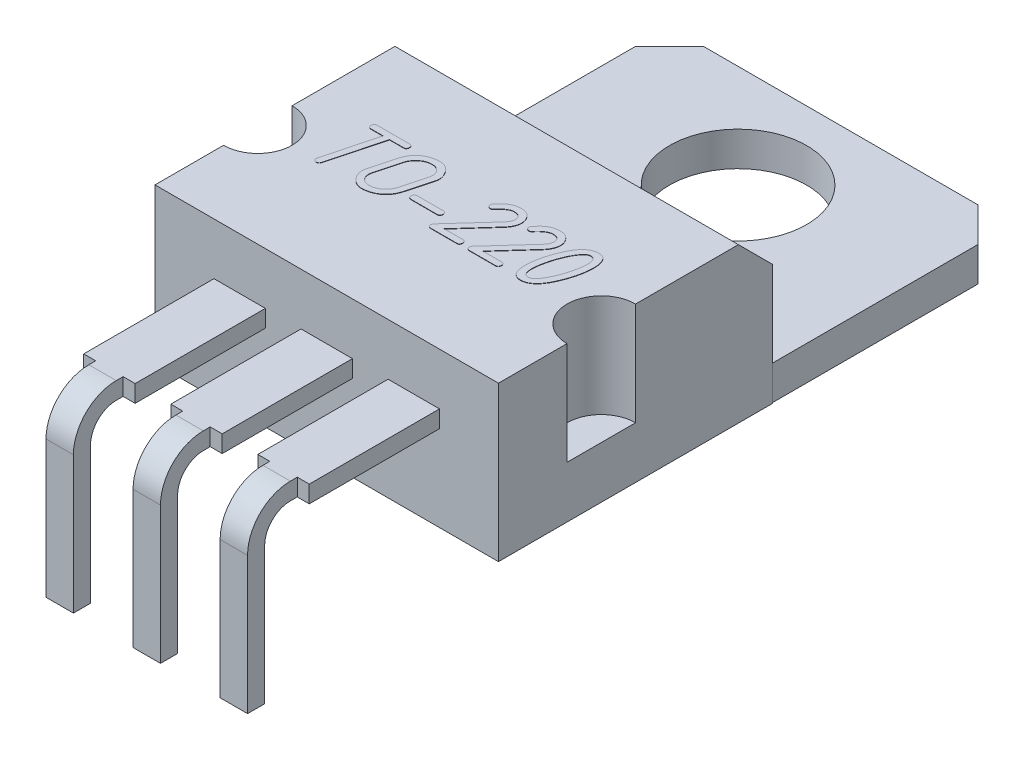
from build123d import *

# Parameters (mm, degrees)
SKETCH_1_R                  = 2
EXTRUDE_1_DEPTH             = 1
EXTRUDE_3_DEPTH             = 1.01
SKETCH_2_5_W                = 10.02
SKETCH_2_5_H                = 8
EXTRUDE_4_DEPTH             = 3.5
SKETCH_3_W                  = 1.5
SKETCH_3_H                  = 0.5
EXTRUDE_5_DEPTH             = 3.8
SKETCH_4_W                  = 0.8
SKETCH_4_H                  = 0.5
PATTERN_LINEAR_1_COUNT      = 2
PATTERN_LINEAR_1_PITCH      = 2.54
PATTERN_LINEAR_1_COUNT_DIR2 = 2
PATTERN_LINEAR_1_PITCH_DIR2 = 2.54
EXTRUDE_6_DEPTH             = 0.01
CHAMFER_1_SIZE              = 1
SKETCH_9_R                  = 1
CUT_EXTRUDE_1_DEPTH         = 3


with BuildPart() as part:
    # Эскиз1 → Бобышка-Вытянуть1 (new body)
    with BuildSketch(Plane(origin=(0, 0, 0), x_dir=(1, 0, 0), z_dir=(0, 1, 0))):
        Polygon((0, 0), (8, 0), (8, 6), (9, 6), (9, 12), (8, 13), (0, 13), (-1, 12), (-1, 6), (0, 6), align=None)
        with Locations((4, 10)):
            Circle(SKETCH_1_R, mode=Mode.SUBTRACT)
    extrude(amount=EXTRUDE_1_DEPTH)

    # Эскиз2 → Бобышка-Вытянуть3 (add)
    with BuildSketch(Plane(origin=(0, 1, 0), x_dir=(1, 0, 0), z_dir=(0, 1, 0))):
        Polygon((-1, 6), (-1.01, 6), (-1.01, -2), (9.01, -2), (9.01, 6), (9, 6), (8, 6), (8, 0), (0, 0), (0, 6), align=None)
    extrude(amount=-EXTRUDE_3_DEPTH)

    # Эскиз2<5> → Бобышка-Вытянуть4 (add)
    with BuildSketch(Plane(origin=(0, 1, 0), x_dir=(1, 0, 0), z_dir=(0, 1, 0))):
        with Locations((4, 2)):
            Rectangle(SKETCH_2_5_W, SKETCH_2_5_H)
    extrude(amount=EXTRUDE_4_DEPTH)

    # Эскиз3 → Бобышка-Вытянуть5 (add)
    with BuildSketch(Plane.XY.offset(2)):
        with Locations((4, 2.74)):
            Rectangle(SKETCH_3_W, SKETCH_3_H)
    extrude_5 = extrude(amount=EXTRUDE_5_DEPTH)

    # По траектории1: sweep along a path in Эскиз7
    with BuildLine(Plane.ZY.offset(-4)) as sweep_1_path:
        Line((5.8, 2.74), (6, 2.74))
        ThreePointArc((6, 2.74), (6.707106781, 2.447106781), (7, 1.74))
        Line((7, 1.74), (7, -2.26))
    # Эскиз4 → По траектории1 (sweep)
    with BuildSketch(Plane.XY.offset(5.8)):
        with Locations((4, 2.74)):
            Rectangle(SKETCH_4_W, SKETCH_4_H)
    sweep_1 = sweep(path=sweep_1_path.line)

    # Линейный массив1: Бобышка-Вытянуть5, Sweep 1 2 × 2
    with Locations(*[Vector(-1, 0, 0) * (i * PATTERN_LINEAR_1_PITCH) + Vector(1, 0, 0) * (j * PATTERN_LINEAR_1_PITCH_DIR2) for i in range(PATTERN_LINEAR_1_COUNT) for j in range(PATTERN_LINEAR_1_COUNT_DIR2) if (i, j) != (0, 0)]):
        add(extrude_5)
        add(sweep_1)

    # Эскиз8 → Бобышка-Вытянуть6 (add)
    # profile 1 of 6: a face of its own
    with BuildSketch(Plane(origin=(0, 4.5, 0), x_dir=(1, 0, 0), z_dir=(0, 1, 0))):
        with BuildLine():
            Line((1.27858567, 2.5547293), (0.859157599, 0.985020757))
            add(Edge.make_bspline(
                [(0.859157599, 0.985020757), (0.855633438, 0.974783342), (0.849087007, 0.955766466), (0.829278615, 0.93328717), (0.803143513, 0.919336806), (0.783409322, 0.918209838), (0.773079427, 0.917619925)],
                knots=[0, 0, 0, 0, 1.086908555, 2.019025704, 2.963055697, 4, 4, 4, 4], degree=3))
            add(Edge.make_bspline(
                [(0.773079427, 0.917619925), (0.767204868, 0.917864101), (0.755608941, 0.918346085), (0.739020981, 0.924335999), (0.722879767, 0.932189694), (0.708692809, 0.944021025), (0.696472399, 0.957627118), (0.687400283, 0.972740133), (0.681742621, 0.98896155), (0.681188277, 1.000135496), (0.680910819, 1.005728242)],
                knots=[0, 0, 0, 0, 0.998523784, 1.971008786, 2.984412935, 4.053273998, 5.101682541, 6.096988731, 7.047511114, 8, 8, 8, 8], degree=3))
            add(Edge.make_bspline(
                [(0.680910819, 1.005728242), (0.681174471, 1.010217201), (0.681723788, 1.019569906), (0.684127251, 1.028627792), (0.685377139, 1.033338221)],
                knots=[0, 0, 0, 0, 0.959927375, 2, 2, 2, 2], degree=3))
            Line((0.685377139, 1.033338221), (1.091000221, 2.5547293))
            Line((1.091000221, 2.5547293), (0.740191069, 2.5547293))
            add(Edge.make_bspline(
                [(0.740191069, 2.5547293), (0.733142702, 2.555099355), (0.719732405, 2.555803425), (0.700802325, 2.559454679), (0.685008305, 2.567050286), (0.671761457, 2.577083859), (0.661525267, 2.59022733), (0.654625853, 2.606462916), (0.650032952, 2.625124331), (0.649779441, 2.638611333), (0.649646577, 2.645679821)],
                knots=[0, 0, 0, 0, 1.152245291, 2.192274096, 3.121243949, 3.987402553, 4.884564444, 5.804293213, 6.849238333, 8, 8, 8, 8], degree=3))
            add(Edge.make_bspline(
                [(0.649646577, 2.645679821), (0.649743167, 2.652894625), (0.649924046, 2.66640549), (0.654831047, 2.685073251), (0.661247518, 2.701465446), (0.672068578, 2.714215792), (0.684731012, 2.72490292), (0.701007181, 2.73161686), (0.719625863, 2.736254033), (0.733119241, 2.736500939), (0.740191069, 2.736630341)],
                knots=[0, 0, 0, 0, 1.171153265, 2.193170214, 3.131774486, 4.010381834, 4.888989181, 5.807411693, 6.850872717, 8, 8, 8, 8], degree=3))
            Line((0.740191069, 2.736630341), (1.677306257, 2.736630341))
            add(Edge.make_bspline(
                [(1.677306257, 2.736630341), (1.684378085, 2.736500939), (1.697871463, 2.736254033), (1.716490145, 2.73161686), (1.732766314, 2.72490292), (1.745428748, 2.714215792), (1.756249808, 2.701465446), (1.762666279, 2.685073251), (1.76757328, 2.66640549), (1.767754159, 2.652894625), (1.767850749, 2.645679821)],
                knots=[0, 0, 0, 0, 1.149127283, 2.192588307, 3.111010819, 3.989618166, 4.868225514, 5.806829786, 6.828846735, 8, 8, 8, 8], degree=3))
            add(Edge.make_bspline(
                [(1.767850749, 2.645679821), (1.767717885, 2.638611333), (1.767464374, 2.625124331), (1.762871473, 2.606462916), (1.755972059, 2.59022733), (1.745735869, 2.577083859), (1.732489021, 2.567050286), (1.716695001, 2.559454679), (1.697764921, 2.555803425), (1.684354624, 2.555099355), (1.677306257, 2.5547293)],
                knots=[0, 0, 0, 0, 1.150761667, 2.195706787, 3.115435556, 4.012597447, 4.878756051, 5.807725904, 6.847754709, 8, 8, 8, 8], degree=3))
            Line((1.677306257, 2.5547293), (1.27858567, 2.5547293))
        make_face()
    # profile 2 of 6: a face of its own
    with BuildSketch(Plane(origin=(0, 4.5, 0), x_dir=(1, 0, 0), z_dir=(0, 1, 0))):
        with BuildLine():
            add(Edge.make_bspline(
                [(2.795104399, 1.46332305), (2.786928876, 1.435359174), (2.770956207, 1.380725643), (2.737010598, 1.304094516), (2.697657346, 1.233771974), (2.651951592, 1.169746038), (2.599331694, 1.112551879), (2.539870738, 1.062550924), (2.474692985, 1.018271023), (2.42702941, 0.995393666), (2.402880278, 0.98380267)],
                knots=[0, 0, 0, 0, 1.08866662, 2.126947775, 3.126561852, 4.09871457, 5.062408504, 6.024945022, 6.999322605, 8, 8, 8, 8], degree=3))
            add(Edge.make_bspline(
                [(2.402880278, 0.98380267), (2.378313867, 0.973613917), (2.329126592, 0.953213826), (2.251070685, 0.932898784), (2.170000672, 0.919735969), (2.114653013, 0.918331963), (2.086583601, 0.917619925)],
                knots=[0, 0, 0, 0, 0.979423391, 1.961017766, 2.965935817, 4, 4, 4, 4], degree=3))
            add(Edge.make_bspline(
                [(2.086583601, 0.917619925), (2.068099229, 0.918506111), (2.031082888, 0.920280766), (1.97641298, 0.933954309), (1.922785348, 0.955983), (1.889641331, 0.977040177), (1.872606259, 0.987862961)],
                knots=[0, 0, 0, 0, 0.969629375, 1.941755521, 2.942121495, 4, 4, 4, 4], degree=3))
            add(Edge.make_bspline(
                [(1.872606259, 0.987862961), (1.857284238, 0.999280668), (1.826674514, 1.02209051), (1.785994525, 1.06285397), (1.749783225, 1.108138787), (1.718218433, 1.157282587), (1.692723202, 1.209468583), (1.673769115, 1.263195678), (1.662388069, 1.318163482), (1.660964025, 1.355132764), (1.660253034, 1.373590616)],
                knots=[0, 0, 0, 0, 1.002747793, 2.003249617, 3.014831478, 4.044394242, 5.065129976, 6.059016044, 7.03091446, 8, 8, 8, 8], degree=3))
            add(Edge.make_bspline(
                [(1.660253034, 1.373590616), (1.660698514, 1.389217442), (1.661561083, 1.419475189), (1.668068975, 1.449031367), (1.67121582, 1.46332305)],
                knots=[0, 0, 0, 0, 1.03291398, 2, 2, 2, 2], degree=3))
            Line((1.67121582, 1.46332305), (1.865703764, 2.190927216))
            add(Edge.make_bspline(
                [(1.865703764, 2.190927216), (1.873980736, 2.218847582), (1.890156577, 2.273412876), (1.922695379, 2.350666683), (1.962400108, 2.420860805), (2.008013489, 2.48481578), (2.060378407, 2.542062832), (2.119197819, 2.592682947), (2.184616777, 2.636704017), (2.232178681, 2.659899905), (2.256303769, 2.671665684)],
                knots=[0, 0, 0, 0, 1.088804569, 2.127871211, 3.127611952, 4.099887855, 5.06028041, 6.022379573, 6.996880622, 8, 8, 8, 8], degree=3))
            add(Edge.make_bspline(
                [(2.256303769, 2.671665684), (2.28087072, 2.681727254), (2.330193321, 2.701927677), (2.408420464, 2.72172286), (2.489621465, 2.734416018), (2.544940948, 2.73588505), (2.573006476, 2.736630341)],
                knots=[0, 0, 0, 0, 0.977386569, 1.962280486, 2.966192936, 4, 4, 4, 4], degree=3))
            add(Edge.make_bspline(
                [(2.573006476, 2.736630341), (2.591746407, 2.735993457), (2.628638946, 2.734739649), (2.682372216, 2.722836434), (2.733257287, 2.704088958), (2.781151244, 2.677835473), (2.825952793, 2.644012243), (2.867342026, 2.602481363), (2.906375224, 2.553851), (2.928562719, 2.517251409), (2.940056792, 2.498291253)],
                knots=[0, 0, 0, 0, 0.975824583, 1.921066047, 2.854300508, 3.795318588, 4.757785637, 5.770664113, 6.845108518, 8, 8, 8, 8], degree=3))
            add(Edge.make_bspline(
                [(2.940056792, 2.498291253), (2.949664431, 2.480804137), (2.968482767, 2.44655239), (2.987087534, 2.391882215), (2.999876632, 2.337151111), (3.001143817, 2.300220739), (3.001773217, 2.281877737)],
                knots=[0, 0, 0, 0, 1.049868008, 2.056360327, 3.034610701, 4, 4, 4, 4], degree=3))
            add(Edge.make_bspline(
                [(3.001773217, 2.281877737), (3.001347839, 2.266649752), (3.000489053, 2.235906277), (2.993247154, 2.20601342), (2.989592343, 2.190927216)],
                knots=[0, 0, 0, 0, 0.99064829, 2, 2, 2, 2], degree=3))
            Line((2.989592343, 2.190927216), (2.795104399, 1.46332305))
        make_face()
        with BuildLine():
            Line((2.607112921, 1.46332305), (2.802006894, 2.190927216))
            add(Edge.make_bspline(
                [(2.802006894, 2.190927216), (2.80566221, 2.205740875), (2.812805325, 2.234689311), (2.813734214, 2.264486387), (2.814187767, 2.279035533)],
                knots=[0, 0, 0, 0, 1.023451362, 2, 2, 2, 2], degree=3))
            add(Edge.make_bspline(
                [(2.814187767, 2.279035533), (2.813910445, 2.292204149), (2.81337161, 2.317790639), (2.80594266, 2.354669122), (2.795395541, 2.389232321), (2.779053093, 2.420693911), (2.759166618, 2.449888457), (2.734406398, 2.476202822), (2.704894397, 2.499356146), (2.682929831, 2.51234242), (2.671671549, 2.518998738)],
                knots=[0, 0, 0, 0, 1.07079464, 2.080543449, 3.053262812, 4.004823275, 4.955872695, 5.923015894, 6.935409288, 8, 8, 8, 8], degree=3))
            add(Edge.make_bspline(
                [(2.671671549, 2.518998738), (2.660309844, 2.524636747), (2.637648961, 2.535881738), (2.600940628, 2.546359094), (2.562895324, 2.553879108), (2.536774468, 2.554442407), (2.523470924, 2.5547293)],
                knots=[0, 0, 0, 0, 0.986514322, 1.967599494, 2.964883452, 4, 4, 4, 4], degree=3))
            add(Edge.make_bspline(
                [(2.523470924, 2.5547293), (2.506112298, 2.554192164), (2.471723503, 2.553128058), (2.421146577, 2.544354378), (2.372272589, 2.529973084), (2.324988204, 2.509979398), (2.279265417, 2.484180699), (2.235286078, 2.452624973), (2.192758886, 2.415580175), (2.166846217, 2.387305477), (2.153578404, 2.372828258)],
                knots=[0, 0, 0, 0, 0.978320997, 1.938130408, 2.884772499, 3.845794787, 4.826494249, 5.838756166, 6.893399279, 8, 8, 8, 8], degree=3))
            add(Edge.make_bspline(
                [(2.153578404, 2.372828258), (2.141840253, 2.358750626), (2.118952051, 2.331300673), (2.09124937, 2.286035237), (2.068351634, 2.239751663), (2.058539163, 2.207063639), (2.053695243, 2.190927216)],
                knots=[0, 0, 0, 0, 1.049505148, 2.046428436, 3.035620582, 4, 4, 4, 4], degree=3))
            Line((2.053695243, 2.190927216), (1.859207299, 1.46332305))
            add(Edge.make_bspline(
                [(1.859207299, 1.46332305), (1.855588248, 1.448506838), (1.848513748, 1.419544194), (1.847241708, 1.38976164), (1.846620396, 1.375214733)],
                knots=[0, 0, 0, 0, 1.023125607, 2, 2, 2, 2], degree=3))
            add(Edge.make_bspline(
                [(1.846620396, 1.375214733), (1.846811631, 1.365319636), (1.847187947, 1.345847842), (1.851415929, 1.317435937), (1.857948174, 1.290399276), (1.866717956, 1.264665272), (1.878752068, 1.240568789), (1.893037066, 1.217738129), (1.909657568, 1.196007067), (1.935701123, 1.169789067), (1.972439451, 1.1414982), (2.022636045, 1.117325398), (2.077576397, 1.102060677), (2.115985772, 1.100382758), (2.135713123, 1.099520966)],
                knots=[0, 0, 0, 0, 0.796530066, 1.567429791, 2.307814666, 3.035325116, 3.7520546, 4.472010561, 5.202537203, 5.950349672, 7.443986541, 8.911614415, 10.41378132, 12, 12, 12, 12], degree=3))
            add(Edge.make_bspline(
                [(2.135713123, 1.099520966), (2.153069709, 1.100064994), (2.187454462, 1.101142755), (2.238227588, 1.109844502), (2.287313795, 1.124733988), (2.33495014, 1.144965901), (2.380781946, 1.171441743), (2.425095527, 1.203115286), (2.46777056, 1.240869371), (2.49382504, 1.269522512), (2.50722976, 1.284264212)],
                knots=[0, 0, 0, 0, 0.971607698, 1.924830837, 2.874400901, 3.838768323, 4.816476348, 5.832365049, 6.884777637, 8, 8, 8, 8], degree=3))
            add(Edge.make_bspline(
                [(2.50722976, 1.284264212), (2.518932365, 1.298363945), (2.541797296, 1.325912465), (2.569799469, 1.370576857), (2.592279365, 1.416090353), (2.602220536, 1.44774482), (2.607112921, 1.46332305)],
                knots=[0, 0, 0, 0, 1.062692188, 2.076322643, 3.053293563, 4, 4, 4, 4], degree=3))
        make_face(mode=Mode.SUBTRACT)
    # profile 3 of 6: a face of its own
    with BuildSketch(Plane(origin=(0, 4.5, 0), x_dir=(1, 0, 0), z_dir=(0, 1, 0))):
        with BuildLine():
            Line((3.852404204, 1.359379597), (3.104092553, 1.359379597))
            add(Edge.make_bspline(
                [(3.104092553, 1.359379597), (3.097044186, 1.359749652), (3.083633889, 1.360453722), (3.064703809, 1.364104977), (3.048909789, 1.371700583), (3.035662941, 1.381734156), (3.02542675, 1.394877628), (3.018527337, 1.411113214), (3.013934435, 1.429774628), (3.013680925, 1.443261631), (3.013548061, 1.450330118)],
                knots=[0, 0, 0, 0, 1.152245291, 2.192274096, 3.121243949, 3.987402553, 4.884564444, 5.804293213, 6.849238333, 8, 8, 8, 8], degree=3))
            add(Edge.make_bspline(
                [(3.013548061, 1.450330118), (3.01364465, 1.457544923), (3.013825529, 1.471055788), (3.01873253, 1.489723548), (3.025149002, 1.506115744), (3.035970061, 1.518866089), (3.048632495, 1.529553217), (3.064908664, 1.536267158), (3.083527346, 1.540904331), (3.097020724, 1.541151237), (3.104092553, 1.541280639)],
                knots=[0, 0, 0, 0, 1.171153265, 2.193170214, 3.131774486, 4.010381834, 4.888989181, 5.807411693, 6.850872717, 8, 8, 8, 8], degree=3))
            Line((3.104092553, 1.541280639), (3.852404204, 1.541280639))
            add(Edge.make_bspline(
                [(3.852404204, 1.541280639), (3.859476032, 1.541151237), (3.87296941, 1.540904331), (3.891588092, 1.536267158), (3.907864261, 1.529553217), (3.920526695, 1.518866089), (3.931347755, 1.506115744), (3.937764226, 1.489723548), (3.942671227, 1.471055788), (3.942852106, 1.457544923), (3.942948696, 1.450330118)],
                knots=[0, 0, 0, 0, 1.149127283, 2.192588307, 3.111010819, 3.989618166, 4.868225514, 5.806829786, 6.828846735, 8, 8, 8, 8], degree=3))
            add(Edge.make_bspline(
                [(3.942948696, 1.450330118), (3.942815832, 1.443261631), (3.942562321, 1.429774628), (3.93796942, 1.411113214), (3.931070006, 1.394877628), (3.920833816, 1.381734156), (3.907586968, 1.371700583), (3.891792948, 1.364104977), (3.872862868, 1.360453722), (3.859452571, 1.359749652), (3.852404204, 1.359379597)],
                knots=[0, 0, 0, 0, 1.150761667, 2.195706787, 3.115435556, 4.012597447, 4.878756051, 5.807725904, 6.847754709, 8, 8, 8, 8], degree=3))
        make_face()
    # profile 4 of 6: a face of its own
    with BuildSketch(Plane(origin=(0, 4.5, 0), x_dir=(1, 0, 0), z_dir=(0, 1, 0))):
        with BuildLine():
            add(Edge.make_bspline(
                [(4.549556187, 2.315984183), (4.54514884, 2.311040073), (4.536507867, 2.30134673), (4.520338463, 2.290491966), (4.501951989, 2.284214916), (4.489105062, 2.28347348), (4.482561384, 2.283095825)],
                knots=[0, 0, 0, 0, 1.025040379, 2.009677726, 2.986214628, 4, 4, 4, 4], degree=3))
            add(Edge.make_bspline(
                [(4.482561384, 2.283095825), (4.476565014, 2.283363955), (4.464731042, 2.283893115), (4.447840542, 2.289430928), (4.432415678, 2.298339767), (4.418439732, 2.309899507), (4.406631174, 2.323851075), (4.398640456, 2.339670029), (4.392756172, 2.356176446), (4.39226548, 2.367767981), (4.392016892, 2.373640316)],
                knots=[0, 0, 0, 0, 1.01324681, 1.999665296, 2.975361523, 4.017776151, 5.060190779, 6.045008368, 7.009590593, 8, 8, 8, 8], degree=3))
            add(Edge.make_bspline(
                [(4.392016892, 2.373640316), (4.393126861, 2.384079172), (4.39540975, 2.405548924), (4.407652361, 2.423362262), (4.413942464, 2.432514537)],
                knots=[0, 0, 0, 0, 0.972424466, 2, 2, 2, 2], degree=3))
            add(Edge.make_bspline(
                [(4.413942464, 2.432514537), (4.433809877, 2.456597176), (4.4717135, 2.50254273), (4.53051834, 2.564085326), (4.587949377, 2.615302963), (4.628038055, 2.642539487), (4.647003174, 2.655424519)],
                knots=[0, 0, 0, 0, 1.15629407, 2.206011236, 3.151301302, 4, 4, 4, 4], degree=3))
            add(Edge.make_bspline(
                [(4.647003174, 2.655424519), (4.669940338, 2.668096378), (4.715816201, 2.693440943), (4.791616254, 2.718016785), (4.871646986, 2.73425509), (4.926942313, 2.73582742), (4.955179269, 2.736630341)],
                knots=[0, 0, 0, 0, 0.972811039, 1.945687229, 2.950950411, 4, 4, 4, 4], degree=3))
            add(Edge.make_bspline(
                [(4.955179269, 2.736630341), (4.971719815, 2.736063023), (5.004059904, 2.734953802), (5.050985281, 2.726937923), (5.094633848, 2.712692907), (5.135689215, 2.693998989), (5.172699078, 2.668068866), (5.207277154, 2.637930595), (5.23846995, 2.601844933), (5.255720308, 2.574465331), (5.264573451, 2.560413707)],
                knots=[0, 0, 0, 0, 1.060694985, 2.073871789, 3.040117736, 3.999202584, 4.954982404, 5.926671157, 6.935936426, 8, 8, 8, 8], degree=3))
            add(Edge.make_bspline(
                [(5.264573451, 2.560413707), (5.272110813, 2.54637466), (5.287127284, 2.518405064), (5.303188523, 2.473263217), (5.312061128, 2.425691588), (5.313420327, 2.393300429), (5.314109003, 2.376888549)],
                knots=[0, 0, 0, 0, 0.993271713, 1.978867136, 2.97593695, 4, 4, 4, 4], degree=3))
            add(Edge.make_bspline(
                [(5.314109003, 2.376888549), (5.313670752, 2.361425981), (5.31278882, 2.330309224), (5.304599212, 2.283935103), (5.292054706, 2.237626219), (5.273937723, 2.191770002), (5.251172243, 2.145994866), (5.222717329, 2.100932884), (5.189873895, 2.055531216), (5.16466182, 2.026695947), (5.151697359, 2.011868378)],
                knots=[0, 0, 0, 0, 0.906955576, 1.825150615, 2.756077876, 3.719491966, 4.714332584, 5.752697099, 6.844400029, 8, 8, 8, 8], degree=3))
            Line((5.151697359, 2.011868378), (4.325022089, 1.099520966))
            Line((4.325022089, 1.099520966), (4.867476981, 1.099520966))
            add(Edge.make_bspline(
                [(4.867476981, 1.099520966), (4.87454881, 1.099391564), (4.888042187, 1.099144658), (4.906660869, 1.094507485), (4.922937038, 1.087793545), (4.935599472, 1.077106417), (4.946420532, 1.064356071), (4.952837003, 1.047963876), (4.957744004, 1.029296115), (4.957924883, 1.01578525), (4.958021473, 1.008570446)],
                knots=[0, 0, 0, 0, 1.149127283, 2.192588307, 3.111010819, 3.989618166, 4.868225514, 5.806829786, 6.828846735, 8, 8, 8, 8], degree=3))
            add(Edge.make_bspline(
                [(4.958021473, 1.008570446), (4.957888609, 1.001501958), (4.957635098, 0.988014956), (4.953042197, 0.969353541), (4.946142783, 0.953117955), (4.935906593, 0.939974484), (4.922659745, 0.929940911), (4.906865725, 0.922345304), (4.887935645, 0.91869405), (4.874525348, 0.91798998), (4.867476981, 0.917619925)],
                knots=[0, 0, 0, 0, 1.150761667, 2.195706787, 3.115435556, 4.012597447, 4.878756051, 5.807725904, 6.847754709, 8, 8, 8, 8], degree=3))
            Line((4.867476981, 0.917619925), (4.119571359, 0.917619925))
            add(Edge.make_bspline(
                [(4.119571359, 0.917619925), (4.112522992, 0.91798998), (4.099112695, 0.91869405), (4.080182615, 0.922345304), (4.064388595, 0.929940911), (4.051141747, 0.939974484), (4.040905557, 0.953117955), (4.034006143, 0.969353541), (4.029413242, 0.988014956), (4.029159731, 1.001501958), (4.029026867, 1.008570446)],
                knots=[0, 0, 0, 0, 1.152245291, 2.192274096, 3.121243949, 3.987402553, 4.884564444, 5.804293213, 6.849238333, 8, 8, 8, 8], degree=3))
            add(Edge.make_bspline(
                [(4.029026867, 1.008570446), (4.02938093, 1.014414131), (4.030065084, 1.02570584), (4.034219202, 1.042164952), (4.041578247, 1.057356332), (4.048610075, 1.066209992), (4.052170526, 1.0706929)],
                knots=[0, 0, 0, 0, 1.035656384, 2.001190839, 2.987935414, 4, 4, 4, 4], degree=3))
            Line((4.052170526, 1.0706929), (5.020955985, 2.138549461))
            add(Edge.make_bspline(
                [(5.020955985, 2.138549461), (5.029727901, 2.148605786), (5.046756222, 2.168127442), (5.069771421, 2.198146564), (5.088573919, 2.228284838), (5.105059731, 2.257470553), (5.116505883, 2.287051557), (5.125773605, 2.315811437), (5.131305658, 2.344464162), (5.131910182, 2.363467509), (5.132207961, 2.372828258)],
                knots=[0, 0, 0, 0, 1.207518674, 2.344073512, 3.417717558, 4.420571707, 5.371213514, 6.2815554, 7.153521357, 8, 8, 8, 8], degree=3))
            add(Edge.make_bspline(
                [(5.132207961, 2.372828258), (5.131565891, 2.387115136), (5.130347207, 2.414232401), (5.119620842, 2.452124493), (5.101910771, 2.484585456), (5.076162079, 2.510939999), (5.043224202, 2.530829639), (5.003643339, 2.545027625), (4.957149201, 2.553374667), (4.923816581, 2.554258306), (4.906049747, 2.5547293)],
                knots=[0, 0, 0, 0, 1.032884659, 1.960470861, 2.824855343, 3.68433611, 4.595465642, 5.587747212, 6.714229588, 8, 8, 8, 8], degree=3))
            add(Edge.make_bspline(
                [(4.906049747, 2.5547293), (4.897092457, 2.554278227), (4.878607218, 2.553347344), (4.850467274, 2.547440929), (4.821276488, 2.537391382), (4.790952843, 2.523427915), (4.7591295, 2.505895107), (4.726243523, 2.484191715), (4.692192666, 2.458556451), (4.669648282, 2.439531113), (4.65796596, 2.429672334)],
                knots=[0, 0, 0, 0, 0.758958301, 1.566269074, 2.425645627, 3.369876423, 4.391168624, 5.501112665, 6.70509631, 8, 8, 8, 8], degree=3))
            add(Edge.make_bspline(
                [(4.65796596, 2.429672334), (4.638409841, 2.411986976), (4.599465005, 2.376767649), (4.566144718, 2.336187194), (4.549556187, 2.315984183)],
                knots=[0, 0, 0, 0, 1.004298417, 2, 2, 2, 2], degree=3))
        make_face()
    # profile 5 of 6: a face of its own
    with BuildSketch(Plane(origin=(0, 4.5, 0), x_dir=(1, 0, 0), z_dir=(0, 1, 0))):
        with BuildLine():
            add(Edge.make_bspline(
                [(5.679941232, 2.315984183), (5.675533885, 2.311040073), (5.666892912, 2.30134673), (5.650723508, 2.290491966), (5.632337034, 2.284214916), (5.619490106, 2.28347348), (5.612946429, 2.283095825)],
                knots=[0, 0, 0, 0, 1.025040379, 2.009677726, 2.986214628, 4, 4, 4, 4], degree=3))
            add(Edge.make_bspline(
                [(5.612946429, 2.283095825), (5.606950058, 2.283363955), (5.595116087, 2.283893115), (5.578225586, 2.289430928), (5.562800722, 2.298339767), (5.548824777, 2.309899507), (5.537016219, 2.323851075), (5.529025501, 2.339670029), (5.523141217, 2.356176446), (5.522650524, 2.367767981), (5.522401937, 2.373640316)],
                knots=[0, 0, 0, 0, 1.01324681, 1.999665296, 2.975361523, 4.017776151, 5.060190779, 6.045008368, 7.009590593, 8, 8, 8, 8], degree=3))
            add(Edge.make_bspline(
                [(5.522401937, 2.373640316), (5.523511906, 2.384079172), (5.525794795, 2.405548924), (5.538037405, 2.423362262), (5.544327509, 2.432514537)],
                knots=[0, 0, 0, 0, 0.972424466, 2, 2, 2, 2], degree=3))
            add(Edge.make_bspline(
                [(5.544327509, 2.432514537), (5.564194921, 2.456597176), (5.602098544, 2.50254273), (5.660903384, 2.564085326), (5.718334422, 2.615302963), (5.7584231, 2.642539487), (5.777388218, 2.655424519)],
                knots=[0, 0, 0, 0, 1.15629407, 2.206011236, 3.151301302, 4, 4, 4, 4], degree=3))
            add(Edge.make_bspline(
                [(5.777388218, 2.655424519), (5.800325382, 2.668096378), (5.846201246, 2.693440943), (5.922001299, 2.718016785), (6.002032031, 2.73425509), (6.057327358, 2.73582742), (6.085564314, 2.736630341)],
                knots=[0, 0, 0, 0, 0.972811039, 1.945687229, 2.950950411, 4, 4, 4, 4], degree=3))
            add(Edge.make_bspline(
                [(6.085564314, 2.736630341), (6.102104859, 2.736063023), (6.134444949, 2.734953802), (6.181370326, 2.726937923), (6.225018893, 2.712692907), (6.266074259, 2.693998989), (6.303084122, 2.668068866), (6.337662199, 2.637930595), (6.368854995, 2.601844933), (6.386105353, 2.574465331), (6.394958496, 2.560413707)],
                knots=[0, 0, 0, 0, 1.060694985, 2.073871789, 3.040117736, 3.999202584, 4.954982404, 5.926671157, 6.935936426, 8, 8, 8, 8], degree=3))
            add(Edge.make_bspline(
                [(6.394958496, 2.560413707), (6.402495857, 2.54637466), (6.417512329, 2.518405064), (6.433573568, 2.473263217), (6.442446173, 2.425691588), (6.443805372, 2.393300429), (6.444494048, 2.376888549)],
                knots=[0, 0, 0, 0, 0.993271713, 1.978867136, 2.97593695, 4, 4, 4, 4], degree=3))
            add(Edge.make_bspline(
                [(6.444494048, 2.376888549), (6.444055797, 2.361425981), (6.443173864, 2.330309224), (6.434984257, 2.283935103), (6.42243975, 2.237626219), (6.404322768, 2.191770002), (6.381557288, 2.145994866), (6.353102374, 2.100932884), (6.320258939, 2.055531216), (6.295046865, 2.026695947), (6.282082403, 2.011868378)],
                knots=[0, 0, 0, 0, 0.906955576, 1.825150615, 2.756077876, 3.719491966, 4.714332584, 5.752697099, 6.844400029, 8, 8, 8, 8], degree=3))
            Line((6.282082403, 2.011868378), (5.455407134, 1.099520966))
            Line((5.455407134, 1.099520966), (5.997862026, 1.099520966))
            add(Edge.make_bspline(
                [(5.997862026, 1.099520966), (6.004933854, 1.099391564), (6.018427232, 1.099144658), (6.037045914, 1.094507485), (6.053322083, 1.087793545), (6.065984517, 1.077106417), (6.076805577, 1.064356071), (6.083222048, 1.047963876), (6.088129049, 1.029296115), (6.088309928, 1.01578525), (6.088406517, 1.008570446)],
                knots=[0, 0, 0, 0, 1.149127283, 2.192588307, 3.111010819, 3.989618166, 4.868225514, 5.806829786, 6.828846735, 8, 8, 8, 8], degree=3))
            add(Edge.make_bspline(
                [(6.088406517, 1.008570446), (6.088273653, 1.001501958), (6.088020143, 0.988014956), (6.083427242, 0.969353541), (6.076527828, 0.953117955), (6.066291637, 0.939974484), (6.05304479, 0.929940911), (6.03725077, 0.922345304), (6.01832069, 0.91869405), (6.004910392, 0.91798998), (5.997862026, 0.917619925)],
                knots=[0, 0, 0, 0, 1.150761667, 2.195706787, 3.115435556, 4.012597447, 4.878756051, 5.807725904, 6.847754709, 8, 8, 8, 8], degree=3))
            Line((5.997862026, 0.917619925), (5.249956403, 0.917619925))
            add(Edge.make_bspline(
                [(5.249956403, 0.917619925), (5.242908037, 0.91798998), (5.229497739, 0.91869405), (5.21056766, 0.922345304), (5.19477364, 0.929940911), (5.181526792, 0.939974484), (5.171290601, 0.953117955), (5.164391187, 0.969353541), (5.159798286, 0.988014956), (5.159544776, 1.001501958), (5.159411912, 1.008570446)],
                knots=[0, 0, 0, 0, 1.152245291, 2.192274096, 3.121243949, 3.987402553, 4.884564444, 5.804293213, 6.849238333, 8, 8, 8, 8], degree=3))
            add(Edge.make_bspline(
                [(5.159411912, 1.008570446), (5.159765975, 1.014414131), (5.160450129, 1.02570584), (5.164604246, 1.042164952), (5.171963291, 1.057356332), (5.178995119, 1.066209992), (5.182555571, 1.0706929)],
                knots=[0, 0, 0, 0, 1.035656384, 2.001190839, 2.987935414, 4, 4, 4, 4], degree=3))
            Line((5.182555571, 1.0706929), (6.15134103, 2.138549461))
            add(Edge.make_bspline(
                [(6.15134103, 2.138549461), (6.160112946, 2.148605786), (6.177141267, 2.168127442), (6.200156465, 2.198146564), (6.218958964, 2.228284838), (6.235444776, 2.257470553), (6.246890928, 2.287051557), (6.25615865, 2.315811437), (6.261690702, 2.344464162), (6.262295227, 2.363467509), (6.262593006, 2.372828258)],
                knots=[0, 0, 0, 0, 1.207518674, 2.344073512, 3.417717558, 4.420571707, 5.371213514, 6.2815554, 7.153521357, 8, 8, 8, 8], degree=3))
            add(Edge.make_bspline(
                [(6.262593006, 2.372828258), (6.261950936, 2.387115136), (6.260732252, 2.414232401), (6.250005887, 2.452124493), (6.232295816, 2.484585456), (6.206547124, 2.510939999), (6.173609246, 2.530829639), (6.134028384, 2.545027625), (6.087534246, 2.553374667), (6.054201626, 2.554258306), (6.036434791, 2.5547293)],
                knots=[0, 0, 0, 0, 1.032884659, 1.960470861, 2.824855343, 3.68433611, 4.595465642, 5.587747212, 6.714229588, 8, 8, 8, 8], degree=3))
            add(Edge.make_bspline(
                [(6.036434791, 2.5547293), (6.027477502, 2.554278227), (6.008992263, 2.553347344), (5.980852319, 2.547440929), (5.951661533, 2.537391382), (5.921337887, 2.523427915), (5.889514544, 2.505895107), (5.856628567, 2.484191715), (5.822577711, 2.458556451), (5.800033326, 2.439531113), (5.788351004, 2.429672334)],
                knots=[0, 0, 0, 0, 0.758958301, 1.566269074, 2.425645627, 3.369876423, 4.391168624, 5.501112665, 6.70509631, 8, 8, 8, 8], degree=3))
            add(Edge.make_bspline(
                [(5.788351004, 2.429672334), (5.768794886, 2.411986976), (5.729850049, 2.376767649), (5.696529763, 2.336187194), (5.679941232, 2.315984183)],
                knots=[0, 0, 0, 0, 1.004298417, 2, 2, 2, 2], degree=3))
        make_face()
    # profile 6 of 6: a face of its own
    with BuildSketch(Plane(origin=(0, 4.5, 0), x_dir=(1, 0, 0), z_dir=(0, 1, 0))):
        with BuildLine():
            add(Edge.make_bspline(
                [(7.26995123, 1.380493111), (7.261036749, 1.361739353), (7.243620983, 1.325101095), (7.2155274, 1.272699464), (7.186658116, 1.223722357), (7.156855591, 1.178343449), (7.125692835, 1.1368012), (7.094356498, 1.098375856), (7.06112043, 1.064300518), (7.027567997, 1.033271377), (6.992953778, 1.005982916), (6.957486359, 0.982168569), (6.920878707, 0.962290547), (6.883291632, 0.945857126), (6.844660362, 0.933236915), (6.805070794, 0.924479368), (6.764772753, 0.918316684), (6.737535043, 0.917853019), (6.723842076, 0.917619925)],
                knots=[0, 0, 0, 0, 1.31396504, 2.567026414, 3.76130175, 4.911102417, 6.000620447, 7.046856242, 8.046363338, 9.010298362, 9.937336866, 10.832938417, 11.710667508, 12.569939145, 13.425874458, 14.277814767, 15.134221374, 16, 16, 16, 16], degree=3))
            add(Edge.make_bspline(
                [(6.723842076, 0.917619925), (6.712043603, 0.917875593), (6.688997729, 0.918374987), (6.655666018, 0.92389175), (6.624447984, 0.932174258), (6.595793028, 0.94467313), (6.569088636, 0.960007049), (6.545050908, 0.979349552), (6.523260991, 1.002022223), (6.503775872, 1.028077184), (6.486787249, 1.057639476), (6.471607726, 1.090300695), (6.459098163, 1.126649269), (6.449192395, 1.166510599), (6.440996555, 1.209597301), (6.435409785, 1.256123205), (6.432252031, 1.306145361), (6.431757091, 1.340697637), (6.431501116, 1.358567539)],
                knots=[0, 0, 0, 0, 0.943365174, 1.842668473, 2.696736533, 3.521664531, 4.337223326, 5.154291285, 5.981633642, 6.848180464, 7.751064454, 8.705803332, 9.72664275, 10.822158527, 11.990591767, 13.23469772, 14.569828524, 16, 16, 16, 16], degree=3))
            add(Edge.make_bspline(
                [(6.431501116, 1.358567539), (6.432256153, 1.39405144), (6.433783821, 1.465846045), (6.444759456, 1.574620508), (6.462727554, 1.685479916), (6.487701457, 1.79862019), (6.519419556, 1.914122935), (6.558539821, 2.031852488), (6.604892132, 2.151848599), (6.64039114, 2.231543214), (6.658471389, 2.272133039)],
                knots=[0, 0, 0, 0, 0.897758864, 1.816436179, 2.763400626, 3.738072067, 4.746655979, 5.79277328, 6.875821826, 8, 8, 8, 8], degree=3))
            add(Edge.make_bspline(
                [(6.658471389, 2.272133039), (6.667363495, 2.291033677), (6.684686077, 2.327853735), (6.713030195, 2.380389326), (6.741635729, 2.429656868), (6.771589172, 2.475079375), (6.802703164, 2.516661002), (6.834208766, 2.555061229), (6.86716095, 2.589543332), (6.900870992, 2.620558828), (6.935468748, 2.647855662), (6.970921811, 2.671709991), (7.007648201, 2.691451525), (7.04502543, 2.708497983), (7.083776495, 2.720981008), (7.123348015, 2.729779553), (7.163650833, 2.735931386), (7.190887899, 2.736396512), (7.204580543, 2.736630341)],
                knots=[0, 0, 0, 0, 1.319636362, 2.570764398, 3.770565317, 4.918591966, 6.006428988, 7.051050555, 8.055189273, 9.017637049, 9.943245234, 10.837464969, 11.713839818, 12.575231358, 13.429846054, 14.280471913, 15.135557177, 16, 16, 16, 16], degree=3))
            add(Edge.make_bspline(
                [(7.204580543, 2.736630341), (7.216379014, 2.736374672), (7.239424884, 2.735875275), (7.272756623, 2.730358529), (7.303974557, 2.722075964), (7.332629869, 2.709577294), (7.359332956, 2.694242635), (7.383375572, 2.674902905), (7.405146723, 2.652219584), (7.424776932, 2.626113008), (7.441504965, 2.596266522), (7.45692848, 2.563452876), (7.46923475, 2.526891249), (7.479244435, 2.486933688), (7.487459807, 2.443708561), (7.49298403, 2.397041051), (7.496176236, 2.346887391), (7.496667453, 2.312334737), (7.496921503, 2.29446464)],
                knots=[0, 0, 0, 0, 0.94157855, 1.839178673, 2.691629227, 3.514994908, 4.329009129, 5.144529656, 5.970305123, 6.835210807, 7.745739726, 8.698670439, 9.72779236, 10.821233357, 11.98745372, 13.239934881, 14.572537102, 16, 16, 16, 16], degree=3))
            add(Edge.make_bspline(
                [(7.496921503, 2.29446464), (7.496163219, 2.2589809), (7.494626104, 2.187051904), (7.483658129, 2.078008496), (7.465742379, 1.966867553), (7.440715359, 1.853601094), (7.409007092, 1.738095817), (7.36987225, 1.620372118), (7.323615182, 1.500469931), (7.288043589, 1.420942306), (7.26995123, 1.380493111)],
                knots=[0, 0, 0, 0, 0.897349411, 1.819014657, 2.768926733, 3.743153642, 4.751277556, 5.796917741, 6.879472326, 8, 8, 8, 8], degree=3))
        make_face()
        with BuildLine():
            add(Edge.make_bspline(
                [(7.240717134, 1.827125133), (7.246672221, 1.850100845), (7.258303672, 1.894976911), (7.273045327, 1.961135697), (7.286421856, 2.023961326), (7.29636576, 2.08376385), (7.304560581, 2.140340707), (7.31092922, 2.193783691), (7.314128525, 2.244347763), (7.314729139, 2.27700193), (7.315020461, 2.292840523)],
                knots=[0, 0, 0, 0, 1.204708347, 2.353031385, 3.440362003, 4.464775335, 5.429561101, 6.342257786, 7.195927883, 8, 8, 8, 8], degree=3))
            add(Edge.make_bspline(
                [(7.315020461, 2.292840523), (7.314604882, 2.313298064), (7.313825666, 2.351656169), (7.306847045, 2.405307999), (7.294474996, 2.450918515), (7.277357437, 2.488779596), (7.25441807, 2.518352814), (7.226440978, 2.540106021), (7.192557655, 2.552658853), (7.168411742, 2.554021033), (7.15585705, 2.5547293)],
                knots=[0, 0, 0, 0, 1.421542027, 2.665406307, 3.749512726, 4.696283625, 5.533696846, 6.325766355, 7.129480493, 8, 8, 8, 8], degree=3))
            add(Edge.make_bspline(
                [(7.15585705, 2.5547293), (7.148522036, 2.554411569), (7.13369361, 2.553769247), (7.111560244, 2.548604635), (7.089472794, 2.540400938), (7.067445114, 2.528852599), (7.045270938, 2.514009616), (7.023224145, 2.495667312), (7.000728848, 2.474482064), (6.978459109, 2.449962969), (6.955962542, 2.422261317), (6.934007785, 2.390852233), (6.911001602, 2.356929424), (6.88877943, 2.319159551), (6.866154632, 2.278415578), (6.843355596, 2.23423613), (6.820229996, 2.1870999), (6.805615139, 2.154164726), (6.798145403, 2.137331374)],
                knots=[0, 0, 0, 0, 0.612491105, 1.238208915, 1.889574883, 2.577622769, 3.311734196, 4.115562866, 4.971727362, 5.892411677, 6.881693737, 7.952045055, 9.093996164, 10.306432429, 11.612744315, 12.988840088, 14.460979255, 16, 16, 16, 16], degree=3))
            add(Edge.make_bspline(
                [(6.798145403, 2.137331374), (6.786260352, 2.109548439), (6.763289642, 2.055851261), (6.733823308, 1.975998945), (6.70775106, 1.900696804), (6.69421696, 1.85102368), (6.687705485, 1.827125133)],
                knots=[0, 0, 0, 0, 1.100013242, 2.126039182, 3.098406995, 4, 4, 4, 4], degree=3))
            add(Edge.make_bspline(
                [(6.687705485, 1.827125133), (6.681750398, 1.804149421), (6.670118947, 1.759273355), (6.655377292, 1.693114569), (6.642000763, 1.63028894), (6.632056859, 1.570486416), (6.623862038, 1.513909559), (6.617493399, 1.460466575), (6.614294094, 1.409902503), (6.61369348, 1.377248336), (6.613402158, 1.361409743)],
                knots=[0, 0, 0, 0, 1.204708347, 2.353031385, 3.440362003, 4.464775335, 5.429561101, 6.342257786, 7.195927883, 8, 8, 8, 8], degree=3))
            add(Edge.make_bspline(
                [(6.613402158, 1.361409743), (6.613744879, 1.340939344), (6.614387802, 1.302538187), (6.622256199, 1.249060256), (6.633811358, 1.203254391), (6.651114167, 1.165503139), (6.674009599, 1.135731048), (6.702256513, 1.114376714), (6.735953354, 1.101500625), (6.759997648, 1.100200526), (6.772565569, 1.099520966)],
                knots=[0, 0, 0, 0, 1.421981532, 2.667546164, 3.749494647, 4.696558264, 5.534230392, 6.33405241, 7.129211351, 8, 8, 8, 8], degree=3))
            add(Edge.make_bspline(
                [(6.772565569, 1.099520966), (6.779900649, 1.099838617), (6.794729208, 1.100480777), (6.816861544, 1.105646639), (6.838953157, 1.113845281), (6.860963925, 1.125414158), (6.88312108, 1.140114138), (6.904804922, 1.158731753), (6.927305504, 1.17974595), (6.949557276, 1.20429056), (6.972032868, 1.232002039), (6.994060968, 1.263274262), (7.016541613, 1.297455294), (7.038843695, 1.335079655), (7.061500227, 1.375742957), (7.083835635, 1.420027323), (7.106507417, 1.467244278), (7.121154595, 1.500099122), (7.128653099, 1.516918892)],
                knots=[0, 0, 0, 0, 0.613451412, 1.240150266, 1.892537491, 2.581664148, 3.316926567, 4.113279556, 4.970786407, 5.892914236, 6.883747362, 7.955776852, 9.093273158, 10.307610365, 11.61597038, 12.989045516, 14.45856627, 16, 16, 16, 16], degree=3))
            add(Edge.make_bspline(
                [(7.128653099, 1.516918892), (7.140463307, 1.544729814), (7.163376301, 1.598685807), (7.193877255, 1.678252157), (7.219698004, 1.75381406), (7.233870659, 1.803245819), (7.240717134, 1.827125133)],
                knots=[0, 0, 0, 0, 1.098318585, 2.130848777, 3.09705725, 4, 4, 4, 4], degree=3))
        make_face(mode=Mode.SUBTRACT)
    extrude(amount=EXTRUDE_6_DEPTH)

    # Фаска1
    chamfer_1_edges = [part.edges().sort_by_distance(p)[0] for p in [
        (4, 4.5, -6),
    ]]
    chamfer(chamfer_1_edges, length=CHAMFER_1_SIZE)

    # Эскиз9 → Вырез-Вытянуть1 (cut)
    with BuildSketch(Plane(origin=(0, 4.5, 0), x_dir=(1, 0, 0), z_dir=(0, 1, 0))):
        with Locations((-1.01, 1)):
            Circle(SKETCH_9_R)
        with Locations((9.01, 1)):
            Circle(SKETCH_9_R)
    extrude(amount=-CUT_EXTRUDE_1_DEPTH, mode=Mode.SUBTRACT)


solid = part.part
